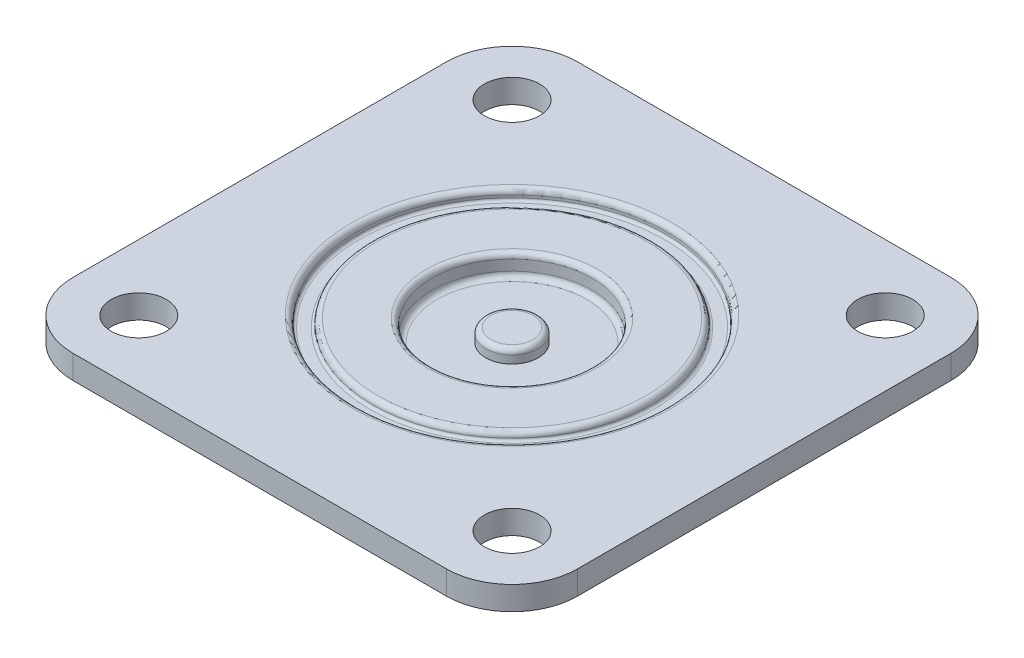
from build123d import *

# Parameters (mm, degrees)
SKETCH_1_R      = 5.25
EXTRUDE_1_DEPTH = 4.5


with BuildPart() as part:
    # 草图1 → 凸台-拉伸1 (new body)
    with BuildSketch(Plane(origin=(0, 0, 0), x_dir=(1, 0, 0), z_dir=(0, 1, 0))):
        with BuildLine():
            Line((-35.5, -48), (35.5, -48))
            ThreePointArc((35.5, -48), (44.338834765, -44.338834765), (48, -35.5))
            Line((48, -35.5), (48, 35.5))
            ThreePointArc((48, 35.5), (44.338834765, 44.338834765), (35.5, 48))
            Line((35.5, 48), (-35.5, 48))
            ThreePointArc((-35.5, 48), (-44.338834765, 44.338834765), (-48, 35.5))
            Line((-48, 35.5), (-48, -35.5))
            ThreePointArc((-48, -35.5), (-44.338834765, -44.338834765), (-35.5, -48))
        make_face()
        with Locations(Location((35.5, -35.5, 0), (0, 0, 270))):
            Circle(SKETCH_1_R, mode=Mode.SUBTRACT)
        with Locations(Location((35.5, 35.5, 0), (0, 0, 270))):
            Circle(SKETCH_1_R, mode=Mode.SUBTRACT)
        with Locations(Location((-35.5, -35.5, 0), (0, 0, 270))):
            Circle(SKETCH_1_R, mode=Mode.SUBTRACT)
        with Locations(Location((-35.5, 35.5, 0), (0, 0, 270))):
            Circle(SKETCH_1_R, mode=Mode.SUBTRACT)
    extrude(amount=-EXTRUDE_1_DEPTH)

    # 草图2 → 旋转1 (revolve)
    with BuildSketch(Plane.XY, mode=Mode.PRIVATE) as revolve_1_sk:
        with BuildLine():
            Line((0, -4.5), (35.5, -4.5))
            Line((35.5, -4.5), (27.998946296, -15.963874529))
            ThreePointArc((27.998946296, -15.963874529), (26.373795231, -17.458373112), (24.233402204, -18))
            Line((24.233402204, -18), (0, -18))
            Line((0, -18), (0, -4.5))
        make_face()
    revolve(revolve_1_sk.sketch.rotate(Axis((0, -18, 0), (0, 1, 0)), 270), axis=Axis((0, -18, 0), (0, 1, 0)))

    # 草图3 → 切除-旋转1 (revolve, cut)
    with BuildSketch(Plane.XY, mode=Mode.PRIVATE) as cut_revolve_1_sk:
        with BuildLine():
            Line((0, 0), (30.5, 0))
            ThreePointArc((30.5, 0), (29.792893219, -0.292893219), (29.5, -1))
            Line((29.5, -1), (29.5, -1.5))
            ThreePointArc((29.5, -1.5), (29.353553391, -1.853553391), (29, -2))
            Line((29, -2), (27, -2))
            ThreePointArc((27, -2), (26.646446609, -1.853553391), (26.5, -1.5))
            ThreePointArc((26.5, -1.5), (26.207106781, -0.792893219), (25.5, -0.5))
            Line((25.5, -0.5), (16.25, -0.5))
            ThreePointArc((16.25, -0.5), (15.542893219, -0.792893219), (15.25, -1.5))
            Line((15.25, -1.5), (15.25, -3.5))
            ThreePointArc((15.25, -3.5), (14.957106781, -4.207106781), (14.25, -4.5))
            Line((14.25, -4.5), (5, -4.5))
            Line((5, -4.5), (5, -3))
            ThreePointArc((5, -3), (4.707106781, -2.292893219), (4, -2))
            Line((4, -2), (0, -2))
            Line((0, -2), (0, 0))
        make_face()
    revolve(cut_revolve_1_sk.sketch.rotate(Axis((0, -2, 0), (0, 1, 0)), 270), axis=Axis((0, -2, 0), (0, 1, 0)), mode=Mode.SUBTRACT)


solid = part.part
